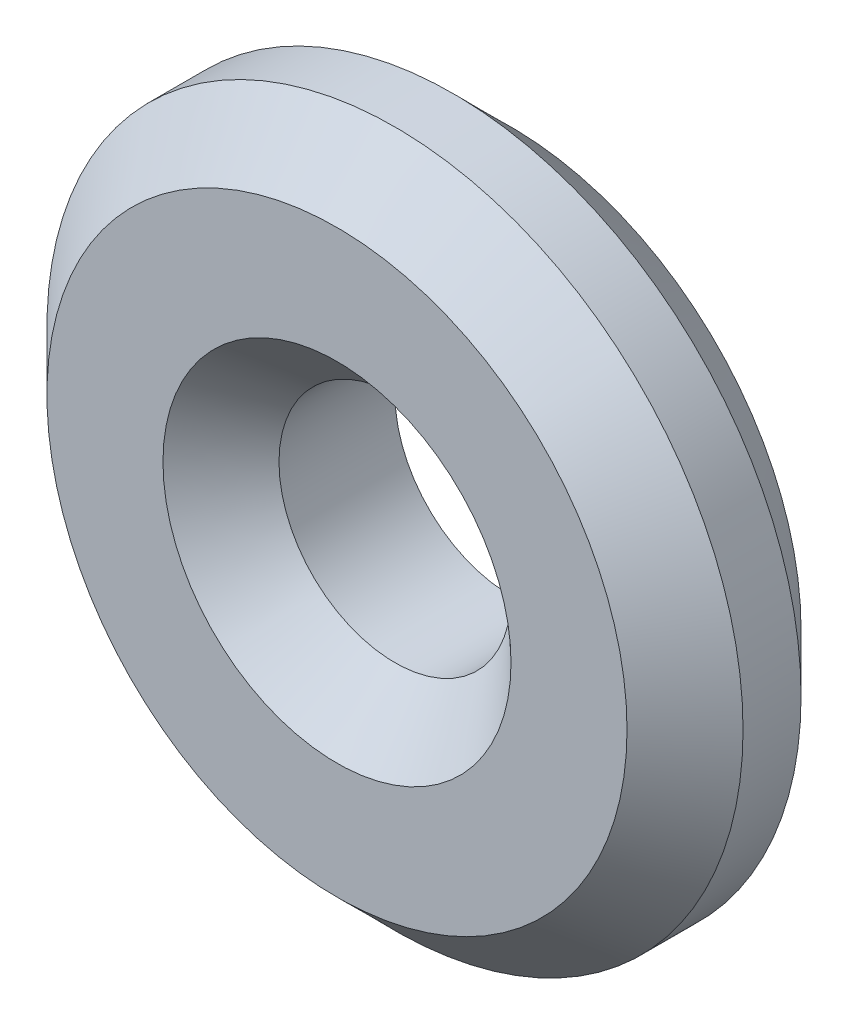
from build123d import *

# Parameters (mm, degrees)
ESQUISSE1_R             = 6
BASE_EXTRUSION_DEPTH    = 3
CHANFREIN1_SIZE         = 1
ESQUISSE2_R             = 2
ENL_V_MAT_EXTRU_1_DEPTH = 10
CHANFREIN3_SIZE         = 1


with BuildPart() as part:
    # Esquisse1 → Base-Extrusion (new body)
    with BuildSketch(Plane.XY):
        Circle(ESQUISSE1_R)
    extrude(amount=-BASE_EXTRUSION_DEPTH)

    # Chanfrein1
    chanfrein1_edges = [part.edges().sort_by_distance(p)[0] for p in [
        (-6, 0, 0),
        (-6, 0, -3),
    ]]
    chamfer(chanfrein1_edges, length=CHANFREIN1_SIZE)

    # Esquisse2 → Enlèv. mat.-Extru.1 (cut, through all)
    with BuildSketch(Plane.XY):
        Circle(ESQUISSE2_R)
    extrude(amount=-ENL_V_MAT_EXTRU_1_DEPTH, mode=Mode.SUBTRACT)

    # Chanfrein3
    chanfrein3_edges = [part.edges().sort_by_distance(p)[0] for p in [
        (-2, 0, 0),
    ]]
    chamfer(chanfrein3_edges, length=CHANFREIN3_SIZE)


solid = part.part
